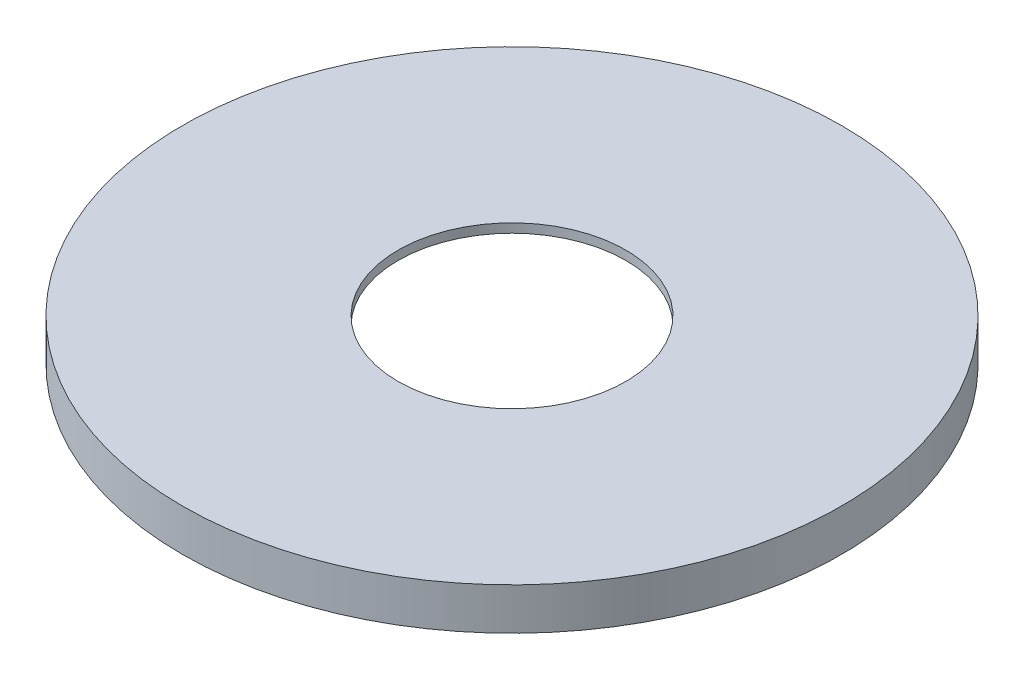
from build123d import *

# Parameters (mm, degrees)
CROQUIS1_R              = 55
SALIENTE_EXTRUIR1_DEPTH = 7
CROQUIS2_R              = 51
CORTAR_EXTRUIR1_DEPTH   = 5.5
CORTAR_EXTRUIR2_REACH   = 80.096
CROQUIS3_R              = 19


with BuildPart() as part:
    # Croquis1 → Saliente-Extruir1 (new body)
    with BuildSketch(Plane(origin=(0, 0, 0), x_dir=(1, 0, 0), z_dir=(0, 1, 0))):
        with Locations(Location((0, 0, 0), (0, 0, 270))):
            Circle(CROQUIS1_R)
    extrude(amount=SALIENTE_EXTRUIR1_DEPTH)

    # Croquis2 → Cortar-Extruir1 (cut)
    with BuildSketch(Plane.XZ):
        with Locations(Location((0, 0, 0), (0, 0, 270))):
            Circle(CROQUIS2_R)
    extrude(amount=-CORTAR_EXTRUIR1_DEPTH, mode=Mode.SUBTRACT)

    # Croquis3 → Cortar-Extruir2 (cut, up to next)
    with BuildSketch(Plane(origin=(0, 7, 0), x_dir=(1, 0, 0), z_dir=(0, 1, 0)), mode=Mode.PRIVATE) as cortar_extruir2_sk1:
        with Locations(Location((0, 0, 0), (0, 0, 270))):
            Circle(CROQUIS3_R)
    cortar_extruir2_tool1 = extrude(cortar_extruir2_sk1.sketch, amount=-CORTAR_EXTRUIR2_REACH, mode=Mode.PRIVATE) & part.part
    add(cortar_extruir2_tool1.solids().sort_by_distance((0, 7, 0))[0], mode=Mode.SUBTRACT)


solid = part.part
